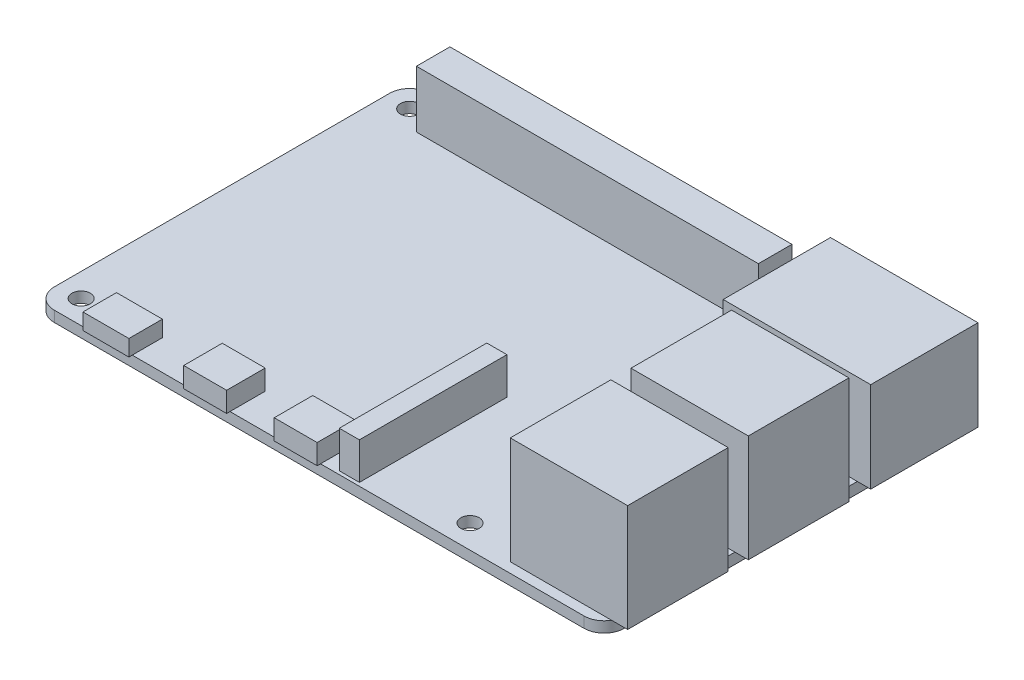
from build123d import *

# Parameters (mm, degrees)
MAIN_BOARD_DEPTH    = 1.6
BOARD_HOLES_REACH   = 103.802
SKETCH3_R           = 1.375
MICROUSB_PWR_W      = 6.85
MICROUSB_PWR_H      = 5
USB_C_DEPTH         = 2.4
SKETCH5_W           = 6.4
SKETCH5_H           = 5.750421271
MICROHDMIS_DEPTH    = 3
SKETCH6_W           = 3
SKETCH6_H           = 22
CAMERA_PORT_DEPTH   = 5.5
SKETCH7_W           = 22
SKETCH7_H           = 16
ETHERNET_PORT_DEPTH = 13.5
SKETCH8_W           = 17.5
SKETCH8_H           = 15
USB_1_DEPTH         = 16
SKETCH9_W           = 17.5
SKETCH9_H           = 15
USB_2_DEPTH         = 16
SKETCH10_W          = 51
SKETCH10_H          = 5
GPIO_DEPTH          = 8.5
SKETCH11_W          = 6
SKETCH11_H          = 11.5
BOSS_EXTRUDE1_DEPTH = 1.125


with BuildPart() as part:
    # Sketch2 → Main Board (new body)
    with BuildSketch(Plane(origin=(0, 0, 0), x_dir=(1, 0, 0), z_dir=(0, 1, 0))):
        with BuildLine():
            Line((3, 0), (82, 0))
            ThreePointArc((82, 0), (84.121320344, 0.878679656), (85, 3))
            Line((85, 3), (85, 53))
            ThreePointArc((85, 53), (84.121320344, 55.121320344), (82, 56))
            Line((82, 56), (3, 56))
            ThreePointArc((3, 56), (0.878679656, 55.121320344), (0, 53))
            Line((0, 53), (0, 3))
            ThreePointArc((0, 3), (0.878679656, 0.878679656), (3, 0))
        make_face()
    extrude(amount=MAIN_BOARD_DEPTH)

    # Sketch3 → Board Holes (cut, up to next)
    with BuildSketch(Plane(origin=(0, 0, 0), x_dir=(1, 0, 0), z_dir=(0, 1, 0)), mode=Mode.PRIVATE) as board_holes_sk1:
        with Locations(Location((3.5, 3.5, 0), (0, 0, 90))):
            Circle(SKETCH3_R)
    board_holes_tool1 = extrude(board_holes_sk1.sketch, amount=BOARD_HOLES_REACH, mode=Mode.PRIVATE) & part.part
    # Sketch3 → Board Holes (cut, up to next)
    with BuildSketch(Plane(origin=(0, 0, 0), x_dir=(1, 0, 0), z_dir=(0, 1, 0)), mode=Mode.PRIVATE) as board_holes_sk2:
        with Locations(Location((3.5, 52.5, 0), (0, 0, 90))):
            Circle(SKETCH3_R)
    board_holes_tool2 = extrude(board_holes_sk2.sketch, amount=BOARD_HOLES_REACH, mode=Mode.PRIVATE) & part.part
    # Sketch3 → Board Holes (cut, up to next)
    with BuildSketch(Plane(origin=(0, 0, 0), x_dir=(1, 0, 0), z_dir=(0, 1, 0)), mode=Mode.PRIVATE) as board_holes_sk3:
        with Locations(Location((61.5, 52.5, 0), (0, 0, 90))):
            Circle(SKETCH3_R)
    board_holes_tool3 = extrude(board_holes_sk3.sketch, amount=BOARD_HOLES_REACH, mode=Mode.PRIVATE) & part.part
    # Sketch3 → Board Holes (cut, up to next)
    with BuildSketch(Plane(origin=(0, 0, 0), x_dir=(1, 0, 0), z_dir=(0, 1, 0)), mode=Mode.PRIVATE) as board_holes_sk4:
        with Locations(Location((61.5, 3.5, 0), (0, 0, 90))):
            Circle(SKETCH3_R)
    board_holes_tool4 = extrude(board_holes_sk4.sketch, amount=BOARD_HOLES_REACH, mode=Mode.PRIVATE) & part.part
    add(board_holes_tool1.solids().sort_by_distance((3.5, 0, -3.5))[0], mode=Mode.SUBTRACT)
    add(board_holes_tool2.solids().sort_by_distance((3.5, 0, -52.5))[0], mode=Mode.SUBTRACT)
    add(board_holes_tool3.solids().sort_by_distance((61.5, 0, -52.5))[0], mode=Mode.SUBTRACT)
    add(board_holes_tool4.solids().sort_by_distance((61.5, 0, -3.5))[0], mode=Mode.SUBTRACT)

    # MicroUSB PWR → USB C (add)
    with BuildSketch(Plane(origin=(0, 1.6, 0), x_dir=(1, 0, 0), z_dir=(0, 1, 0))):
        with Locations((11.2, 2)):
            Rectangle(MICROUSB_PWR_W, MICROUSB_PWR_H)
    extrude(amount=USB_C_DEPTH)

    # Sketch5 → MicroHDMIs (add)
    with BuildSketch(Plane(origin=(0, 1.6, 0), x_dir=(1, 0, 0), z_dir=(0, 1, 0))):
        with Locations((26, 2.375210636)):
            Rectangle(SKETCH5_W, SKETCH5_H)
        with Locations((39.5, 2.375210636)):
            Rectangle(SKETCH5_W, SKETCH5_H)
    extrude(amount=MICROHDMIS_DEPTH)

    # Sketch6 → Camera Port (add)
    with BuildSketch(Plane(origin=(0, 1.6, 0), x_dir=(1, 0, 0), z_dir=(0, 1, 0))):
        with Locations((46.5, 11.5)):
            Rectangle(SKETCH6_W, SKETCH6_H)
    extrude(amount=CAMERA_PORT_DEPTH)

    # Sketch7 → Ethernet port (add)
    with BuildSketch(Plane(origin=(0, 1.6, 0), x_dir=(1, 0, 0), z_dir=(0, 1, 0))):
        with Locations((76, 45.75)):
            Rectangle(SKETCH7_W, SKETCH7_H)
    extrude(amount=ETHERNET_PORT_DEPTH)

    # Sketch8 → USB 1 (add)
    with BuildSketch(Plane(origin=(0, 1.6, 0), x_dir=(1, 0, 0), z_dir=(0, 1, 0))):
        with Locations((78.25, 9)):
            Rectangle(SKETCH8_W, SKETCH8_H)
    extrude(amount=USB_1_DEPTH)

    # Sketch9 → USB 2 (add)
    with BuildSketch(Plane(origin=(0, 1.6, 1.6), x_dir=(1, 0, 0), z_dir=(0, 1, 0))):
        with Locations((78.25, 28.6)):
            Rectangle(SKETCH9_W, SKETCH9_H)
    extrude(amount=USB_2_DEPTH)

    # Sketch10 → GPIO (add)
    with BuildSketch(Plane(origin=(0, 1.6, 0), x_dir=(1, 0, 0), z_dir=(0, 1, 0))):
        with Locations((32.5, 52.5)):
            Rectangle(SKETCH10_W, SKETCH10_H)
    extrude(amount=GPIO_DEPTH)

    # Sketch11 → Boss-Extrude1 (add)
    with BuildSketch(Plane.XZ):
        with Locations((9, -28)):
            Rectangle(SKETCH11_W, SKETCH11_H)
    extrude(amount=BOSS_EXTRUDE1_DEPTH)


solid = part.part
